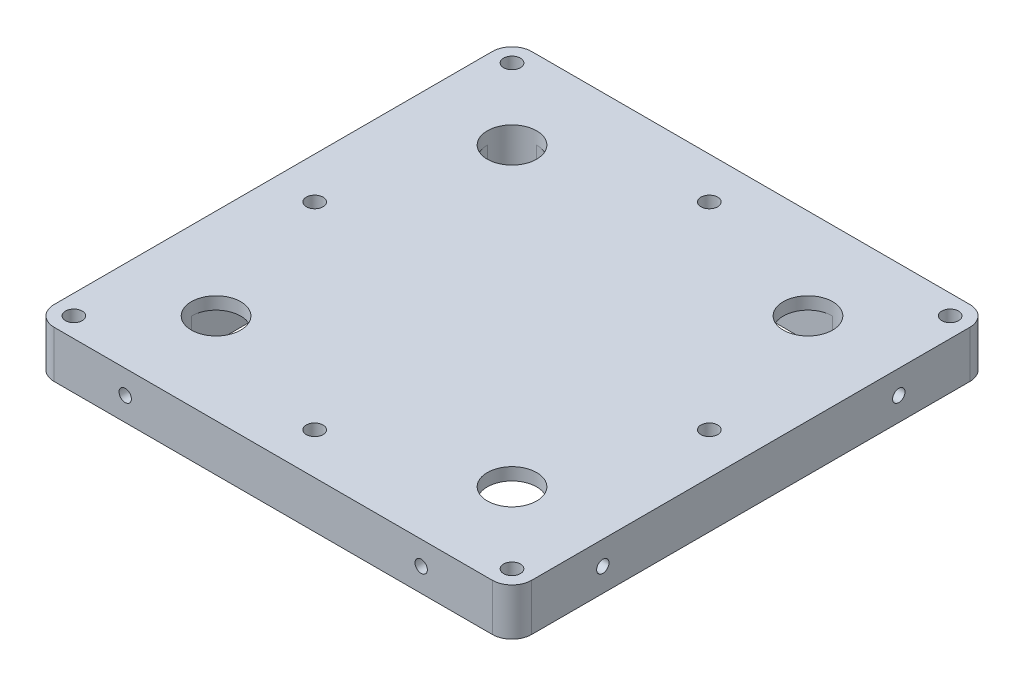
from build123d import *

# Parameters (mm, degrees)
SKETCH1_W                     = 96.825
SKETCH1_H                     = 96.825
BOSS_EXTRUDE1_DEPTH           = 4.7625
FILLET1_R                     = 4
M3X0_5_TAPPED_HOLE1_D         = 2.5
M3X0_5_TAPPED_HOLE1_DEPTH     = 10
M3X0_5_TAPPED_HOLE1_TIP       = 0.751075774
M3X0_5_TAPPED_HOLE2_D         = 2.5
M3X0_5_TAPPED_HOLE2_DEPTH     = 10
M3X0_5_TAPPED_HOLE2_TIP       = 0.751075774
M3_CLEARANCE_HOLE1_D          = 3.4
M3X0_5_TAPPED_HOLE3_D         = 2.5
M3X0_5_TAPPED_HOLE3_DEPTH     = 10
M3X0_5_TAPPED_HOLE3_TIP       = 0.751075774
M3X0_5_TAPPED_HOLE4_D         = 2.5
M3X0_5_TAPPED_HOLE4_DEPTH     = 10
M3X0_5_TAPPED_HOLE4_TIP       = 0.751075774
CSK_FOR_M3_SFHCS1_D           = 3.4
CSK_FOR_M3_SFHCS1_CSINK_D     = 6.72
CSK_FOR_M3_SFHCS1_CSINK_ANGLE = 90
CUT_EXTRUDE1_DEPTH            = 7
SKETCH21_R                    = 5
CUT_EXTRUDE2_DEPTH            = 69.822527653


with BuildPart() as part:
    # Sketch1 → Boss-Extrude1 (new, symmetric)
    with BuildSketch(Plane(origin=(0, 0, 0), x_dir=(1, 0, 0), z_dir=(0, 1, 0))):
        Rectangle(SKETCH1_W, SKETCH1_H)
    extrude(amount=BOSS_EXTRUDE1_DEPTH, both=True)

    # Fillet1
    fillet1_edges = [part.edges().sort_by_distance(p)[0] for p in [
        (-48.4125, 0, -48.4125),
        (48.4125, 0, -48.4125),
        (48.4125, 0, 48.4125),
        (-48.4125, 0, 48.4125),
    ]]
    fillet(fillet1_edges, radius=FILLET1_R)

    # M3x0.5 Tapped Hole1
    with Locations(Plane.ZY.offset(48.4125)):
        with Locations((-30, 0), (30, 0)):
            Hole(M3X0_5_TAPPED_HOLE1_D / 2, depth=M3X0_5_TAPPED_HOLE1_DEPTH)
            with Locations((0, 0, -(M3X0_5_TAPPED_HOLE1_DEPTH + M3X0_5_TAPPED_HOLE1_TIP / 2))):  # 118° drill point
                Cone(0, M3X0_5_TAPPED_HOLE1_D / 2, M3X0_5_TAPPED_HOLE1_TIP, mode=Mode.SUBTRACT)

    # M3x0.5 Tapped Hole2
    with Locations(Plane(origin=(0, 0, -48.4125), x_dir=(-1, 0, 0), z_dir=(0, 0, -1))):
        with Locations((-30, 0), (30, 0)):
            Hole(M3X0_5_TAPPED_HOLE2_D / 2, depth=M3X0_5_TAPPED_HOLE2_DEPTH)
            with Locations((0, 0, -(M3X0_5_TAPPED_HOLE2_DEPTH + M3X0_5_TAPPED_HOLE2_TIP / 2))):  # 118° drill point
                Cone(0, M3X0_5_TAPPED_HOLE2_D / 2, M3X0_5_TAPPED_HOLE2_TIP, mode=Mode.SUBTRACT)

    # M3 Clearance Hole1 (through all)
    with Locations(Plane(origin=(0, 4.7625, 0), x_dir=(1, 0, 0), z_dir=(0, 1, 0))):
        with Locations((-44.4125, 44.4125), (44.4125, 44.4125), (44.4125, -44.4125), (-44.4125, -44.4125)):
            Hole(M3_CLEARANCE_HOLE1_D / 2)

    # M3x0.5 Tapped Hole3
    with Locations(Plane(origin=(48.4125, 0, 0), x_dir=(0, 0, -1), z_dir=(1, 0, 0))):
        with Locations((-30, 0), (30, 0)):
            Hole(M3X0_5_TAPPED_HOLE3_D / 2, depth=M3X0_5_TAPPED_HOLE3_DEPTH)
            with Locations((0, 0, -(M3X0_5_TAPPED_HOLE3_DEPTH + M3X0_5_TAPPED_HOLE3_TIP / 2))):  # 118° drill point
                Cone(0, M3X0_5_TAPPED_HOLE3_D / 2, M3X0_5_TAPPED_HOLE3_TIP, mode=Mode.SUBTRACT)

    # M3x0.5 Tapped Hole4
    with Locations(Plane.XY.offset(48.4125)):
        with Locations((-30, 0), (30, 0)):
            Hole(M3X0_5_TAPPED_HOLE4_D / 2, depth=M3X0_5_TAPPED_HOLE4_DEPTH)
            with Locations((0, 0, -(M3X0_5_TAPPED_HOLE4_DEPTH + M3X0_5_TAPPED_HOLE4_TIP / 2))):  # 118° drill point
                Cone(0, M3X0_5_TAPPED_HOLE4_D / 2, M3X0_5_TAPPED_HOLE4_TIP, mode=Mode.SUBTRACT)

    # CSK for M3 SFHCS1 (through all)
    with Locations(Plane(origin=(0, -4.7625, 0), x_dir=(-1, 0, 0), z_dir=(0, -1, 0))):
        with Locations((-40, 0), (0, 40), (40, 0), (0, -40)):
            CounterSinkHole(CSK_FOR_M3_SFHCS1_D / 2, CSK_FOR_M3_SFHCS1_CSINK_D / 2, counter_sink_angle=CSK_FOR_M3_SFHCS1_CSINK_ANGLE)

    # Sketch20 → Cut-Extrude1 (cut)
    with BuildSketch(Plane.XZ.offset(4.7625)):
        with BuildLine():
            Line((30, -35), (-30, -35))
            ThreePointArc((-30, -35), (-33.535533906, -33.535533906), (-35, -30))
            Line((-35, -30), (-35, 30))
            ThreePointArc((-35, 30), (-33.535533906, 33.535533906), (-30, 35))
            Line((-30, 35), (30, 35))
            ThreePointArc((30, 35), (33.535533906, 33.535533906), (35, 30))
            Line((35, 30), (35, -30))
            ThreePointArc((35, -30), (33.535533906, -33.535533906), (30, -35))
        make_face()
    extrude(amount=-CUT_EXTRUDE1_DEPTH, mode=Mode.SUBTRACT)

    # Sketch21 → Cut-Extrude2 (cut, through all)
    with BuildSketch(Plane.XZ.offset(-2.2375)):
        with Locations(Location((-30, 30, 0), (0, 0, 270))):
            Circle(SKETCH21_R)
        with Locations(Location((30, 30, 0), (0, 0, 270))):
            Circle(SKETCH21_R)
        with Locations(Location((30, -30, 0), (0, 0, 270))):
            Circle(SKETCH21_R)
        with Locations(Location((-30, -30, 0), (0, 0, 270))):
            Circle(SKETCH21_R)
    extrude(amount=-CUT_EXTRUDE2_DEPTH, mode=Mode.SUBTRACT)


solid = part.part
